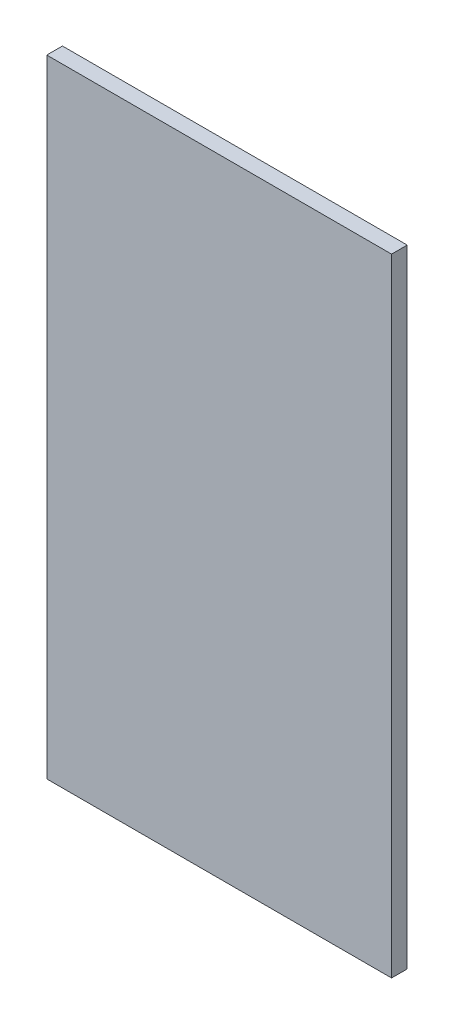
from build123d import *

# Parameters (mm, degrees)
CROQUIS1_W              = 220
CROQUIS1_H              = 400
SALIENTE_EXTRUIR1_DEPTH = 10


with BuildPart() as part:
    # Croquis1 → Saliente-Extruir1 (new body)
    with BuildSketch(Plane.XY):
        Rectangle(CROQUIS1_W, CROQUIS1_H)
    extrude(amount=SALIENTE_EXTRUIR1_DEPTH)


solid = part.part
